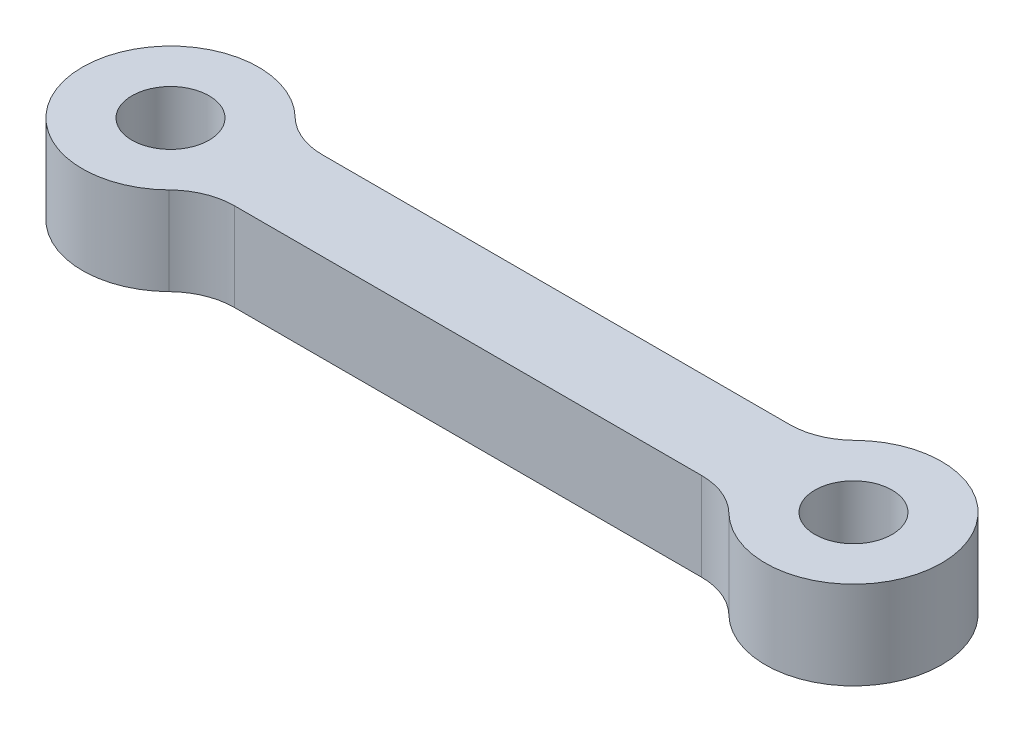
from build123d import *

# Parameters (mm, degrees)
SKETCH1_R           = 1.75
BOSS_EXTRUDE1_DEPTH = 4
FILLET1_R           = 3


with BuildPart() as part:
    # Sketch1 → Boss-Extrude1 (new body)
    with BuildSketch(Plane(origin=(0, 0, 0), x_dir=(1, 0, 0), z_dir=(0, 1, 0))):
        with BuildLine():
            ThreePointArc((3.464101615, 2), (-4, 0), (3.464101615, -2))
            Line((3.464101615, -2), (27.535898385, -2))
            ThreePointArc((27.535898385, -2), (35, 0), (27.535898385, 2))
            Line((27.535898385, 2), (3.464101615, 2))
        make_face()
        with Locations(Location((0, 0, 0), (0, 0, 270))):
            Circle(SKETCH1_R, mode=Mode.SUBTRACT)
        with Locations(Location((31, 0, 0), (0, 0, 270))):
            Circle(SKETCH1_R, mode=Mode.SUBTRACT)
    extrude(amount=BOSS_EXTRUDE1_DEPTH)

    # Fillet1
    fillet1_edges = [part.edges().sort_by_distance(p)[0] for p in [
        (27.535898385, 2, 2),
        (3.464101615, 2, 2),
        (3.464101615, 2, -2),
        (27.535898385, 2, -2),
    ]]
    fillet(fillet1_edges, radius=FILLET1_R)


solid = part.part
